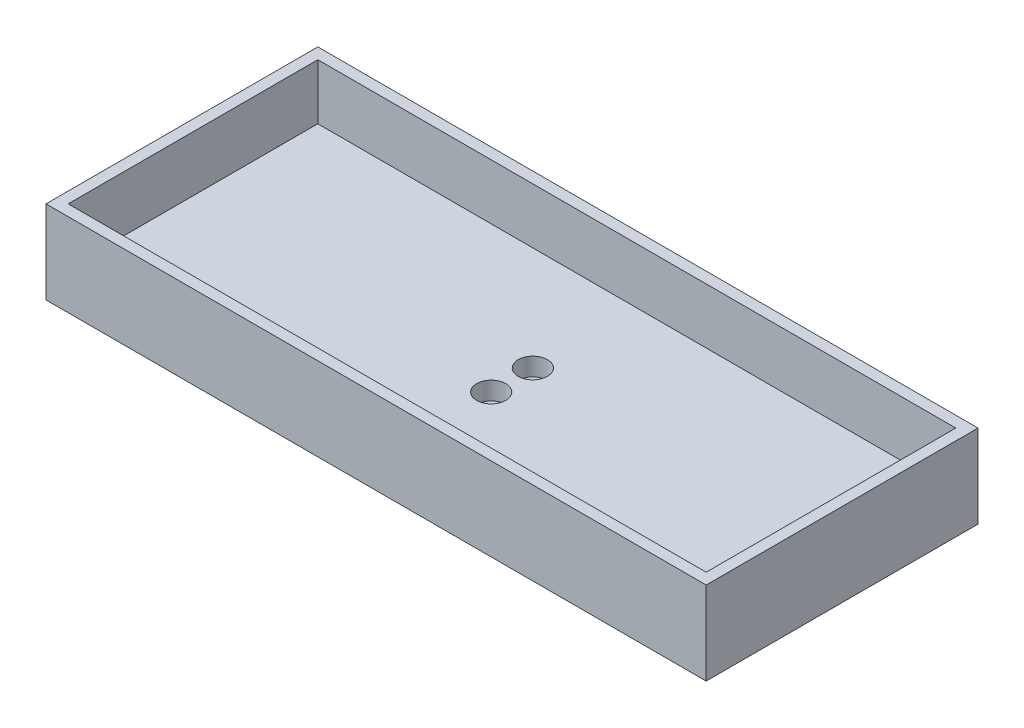
from build123d import *

# Parameters (mm, degrees)
SKETCH1_W           = 238
SKETCH1_H           = 98
SKETCH1_W_2         = 230
SKETCH1_H_2         = 90
BOSS_EXTRUDE1_DEPTH = 30
SKETCH1_2_W         = 230
SKETCH1_2_H         = 90
BOSS_EXTRUDE2_DEPTH = 10
SKETCH3_R           = 3.2
CUT_EXTRUDE1_DEPTH  = 131.238243231
SKETCH3_3_R         = 5.25
CUT_EXTRUDE2_DEPTH  = 6.5


with BuildPart() as part:
    # Sketch1 → Boss-Extrude1 (new body)
    with BuildSketch(Plane(origin=(0, 0, 0), x_dir=(1, 0, 0), z_dir=(0, 1, 0))):
        Rectangle(SKETCH1_W, SKETCH1_H)
        Rectangle(SKETCH1_W_2, SKETCH1_H_2, mode=Mode.SUBTRACT)
    extrude(amount=BOSS_EXTRUDE1_DEPTH)


with BuildPart() as body_2:
    # Sketch1<2> → Boss-Extrude2 (new body)
    with BuildSketch(Plane(origin=(0, 0, 0), x_dir=(1, 0, 0), z_dir=(0, 1, 0))):
        Rectangle(SKETCH1_2_W, SKETCH1_2_H)
    extrude(amount=BOSS_EXTRUDE2_DEPTH)

    # Sketch3 → Cut-Extrude1 (cut, through all)
    with BuildSketch(Plane(origin=(0, 10, 0), x_dir=(1, 0, 0), z_dir=(0, 1, 0))):
        with Locations((0, 7.5)):
            Circle(SKETCH3_R)
        with Locations((0, -7.5)):
            Circle(SKETCH3_R)
    extrude(amount=-CUT_EXTRUDE1_DEPTH, mode=Mode.SUBTRACT)

    # Sketch3<3> → Cut-Extrude2 (cut)
    with BuildSketch(Plane(origin=(0, 10, 0), x_dir=(1, 0, 0), z_dir=(0, 1, 0))):
        with Locations((0, 7.5)):
            Circle(SKETCH3_3_R)
        with Locations((0, -7.5)):
            Circle(SKETCH3_3_R)
    extrude(amount=-CUT_EXTRUDE2_DEPTH, mode=Mode.SUBTRACT)


solid = Compound([part.part, body_2.part])
